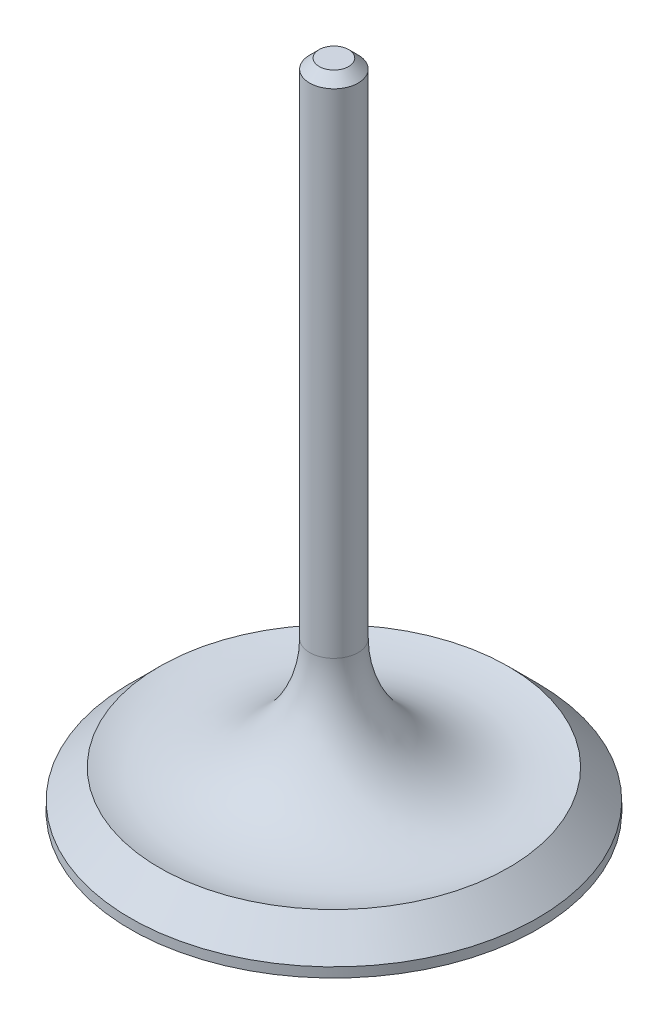
from build123d import *

# Parameters (mm, degrees)
CHAMFER1_SIZE = 1.25


with BuildPart() as part:
    # Sketch2 → Revolve1 (revolve)
    with BuildSketch(Plane(origin=(0, 0, 0), x_dir=(0, 0, -1), z_dir=(1, 0, 0))):
        with BuildLine():
            Line((0, 0), (0, 85.55))
            Line((0, 85.55), (3.18, 85.55))
            Line((3.18, 85.55), (3.18, 19.672381574))
            ThreePointArc((3.18, 19.672381574), (9.346911318, 7.422483615), (22.86, 5.08))
            Line((22.86, 5.08), (26.67, 1.27))
            Line((26.67, 1.27), (26.67, 0))
            Line((26.67, 0), (0, 0))
        make_face()
    revolve(axis=Axis((0, 0, 0), (0, 1, 0)))

    # Chamfer1
    chamfer1_edges = [part.edges().sort_by_distance(p)[0] for p in [
        (0, 85.55, 3.18),
    ]]
    chamfer(chamfer1_edges, length=CHAMFER1_SIZE)


solid = part.part
